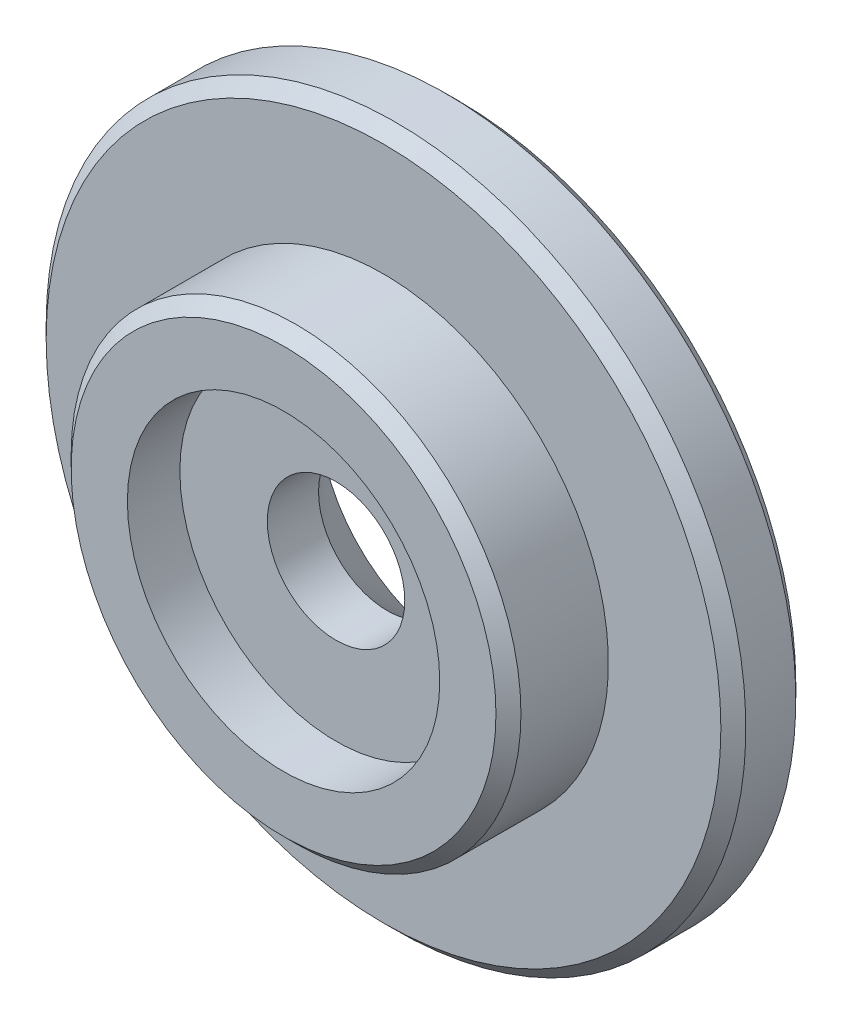
from build123d import *

# Parameters (mm, degrees)
SKETCH_1_R                = 9
EXTRUDE_1_DEPTH           = 4
SKETCH_2_R                = 14
EXTRUDE_2_DEPTH           = 3
SKETCH_3_R                = 6.25
CUT_EXTRUDE_1_DEPTH       = 2.1
HOLE_WIZARD_1_D           = 5.5
HOLE_WIZARD_1_CSINK_D     = 11.2
HOLE_WIZARD_1_CSINK_ANGLE = 90
CHAMFER_1_SIZE            = 0.5


with BuildPart() as part:
    # 草图1 → 凸台-拉伸1 (new body)
    with BuildSketch(Plane.XY):
        Circle(SKETCH_1_R)
    extrude(amount=EXTRUDE_1_DEPTH)

    # 草图2 → 凸台-拉伸2 (add)
    with BuildSketch(Plane(origin=(0, 0, 0), x_dir=(-1, 0, 0), z_dir=(0, 0, -1))):
        Circle(SKETCH_2_R)
    extrude(amount=EXTRUDE_2_DEPTH)

    # 草图3 → 切除-拉伸1 (cut)
    with BuildSketch(Plane.XY.offset(4)):
        Circle(SKETCH_3_R)
    extrude(amount=-CUT_EXTRUDE_1_DEPTH, mode=Mode.SUBTRACT)

    # 打孔尺寸根据开槽半沉头木螺钉的类型1 (through all)
    with Locations(Plane(origin=(0, 0, -3), x_dir=(-1, 0, 0), z_dir=(0, 0, -1))):
        with Locations((0, 0)):
            CounterSinkHole(HOLE_WIZARD_1_D / 2, HOLE_WIZARD_1_CSINK_D / 2, counter_sink_angle=HOLE_WIZARD_1_CSINK_ANGLE)

    # 倒角1
    chamfer_1_edges = [part.edges().sort_by_distance(p)[0] for p in [
        (-9, 0, 4),
        (14, 0, 0),
        (14, 0, -3),
    ]]
    chamfer(chamfer_1_edges, length=CHAMFER_1_SIZE)


solid = part.part
